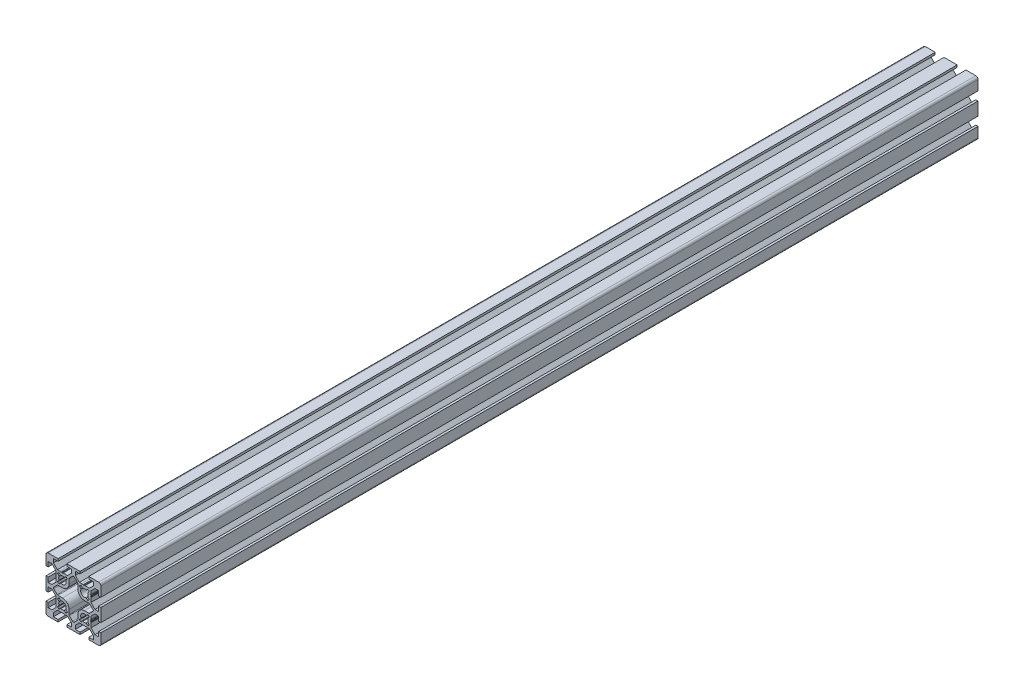
from build123d import *

# Parameters (mm, degrees)
BOSS_EXTRUDE1_DEPTH = 800
CUT_EXTRUDE1_DEPTH  = 801.780868902
CUT_EXTRUDE2_DEPTH  = 801.780868902
CUT_EXTRUDE3_DEPTH  = 801.780868902
CUT_EXTRUDE4_DEPTH  = 801.780868902


with BuildPart() as part:
    # Sketch1 → Boss-Extrude1 (new body)
    with BuildSketch(Plane.XY):
        with BuildLine():
            Line((-25, 23), (-25, 14))
            Line((-25, 14), (-23, 14))
            Line((-23, 14), (-23, 18.25))
            Line((-23, 18.25), (-19.664213562, 18.25))
            Line((-19.664213562, 18.25), (-16, 14.585786438))
            Line((-16, 14.585786438), (-16, 10.653589838))
            ThreePointArc((-16, 10.653589838), (-15.982962913, 10.524180316), (-15.933012702, 10.403589838))
            Line((-15.933012702, 10.403589838), (-15.7, 10))
            Line((-15.7, 10), (-15.933012702, 9.596410162))
            ThreePointArc((-15.933012702, 9.596410162), (-16, 9.346410162), (-15.933012702, 9.096410162))
            Line((-15.933012702, 9.096410162), (-15.750976592, 8.781114371))
            Line((-15.750976592, 8.781114371), (-16, 7.5))
            Line((-16, 7.5), (-16, 5.414213562))
            Line((-16, 5.414213562), (-19.664213562, 1.75))
            Line((-19.664213562, 1.75), (-23, 1.75))
            Line((-23, 1.75), (-23, 6))
            Line((-23, 6), (-25, 6))
            Line((-25, 6), (-25, -6))
            Line((-25, -6), (-23, -6))
            Line((-23, -6), (-23, -1.75))
            Line((-23, -1.75), (-19.664213562, -1.75))
            Line((-19.664213562, -1.75), (-16, -5.414213562))
            Line((-16, -5.414213562), (-16, -9.346410162))
            ThreePointArc((-16, -9.346410162), (-15.982962913, -9.475819684), (-15.933012702, -9.596410162))
            Line((-15.933012702, -9.596410162), (-15.7, -10))
            Line((-15.7, -10), (-15.933012702, -10.403589838))
            ThreePointArc((-15.933012702, -10.403589838), (-16, -10.653589838), (-15.933012702, -10.903589838))
            Line((-15.933012702, -10.903589838), (-15.750976592, -11.218885629))
            Line((-15.750976592, -11.218885629), (-16, -12.5))
            Line((-16, -12.5), (-16, -14.585786438))
            Line((-16, -14.585786438), (-19.664213562, -18.25))
            Line((-19.664213562, -18.25), (-23, -18.25))
            Line((-23, -18.25), (-23, -14))
            Line((-23, -14), (-25, -14))
            Line((-25, -14), (-25, -23))
            ThreePointArc((-25, -23), (-24.414213562, -24.414213562), (-23, -25))
            Line((-23, -25), (-14, -25))
            Line((-14, -25), (-14, -23))
            Line((-14, -23), (-18.25, -23))
            Line((-18.25, -23), (-18.25, -19.664213562))
            Line((-18.25, -19.664213562), (-14.585786438, -16))
            Line((-14.585786438, -16), (-10.653589838, -16))
            ThreePointArc((-10.653589838, -16), (-10.524180316, -15.982962913), (-10.403589838, -15.933012702))
            Line((-10.403589838, -15.933012702), (-10, -15.7))
            Line((-10, -15.7), (-9.596410162, -15.933012702))
            ThreePointArc((-9.596410162, -15.933012702), (-9.346410162, -16), (-9.096410162, -15.933012702))
            Line((-9.096410162, -15.933012702), (-8.781114371, -15.750976592))
            Line((-8.781114371, -15.750976592), (-7.5, -16))
            Line((-7.5, -16), (-5.414213562, -16))
            Line((-5.414213562, -16), (-1.75, -19.664213562))
            Line((-1.75, -19.664213562), (-1.75, -23))
            Line((-1.75, -23), (-6, -23))
            Line((-6, -23), (-6, -25))
            Line((-6, -25), (6, -25))
            Line((6, -25), (6, -23))
            Line((6, -23), (1.75, -23))
            Line((1.75, -23), (1.75, -19.664213562))
            Line((1.75, -19.664213562), (5.414213562, -16))
            Line((5.414213562, -16), (9.346410162, -16))
            ThreePointArc((9.346410162, -16), (9.475819684, -15.982962913), (9.596410162, -15.933012702))
            Line((9.596410162, -15.933012702), (10, -15.7))
            Line((10, -15.7), (10.403589838, -15.933012702))
            ThreePointArc((10.403589838, -15.933012702), (10.653589838, -16), (10.903589838, -15.933012702))
            Line((10.903589838, -15.933012702), (11.218885629, -15.750976592))
            Line((11.218885629, -15.750976592), (12.5, -16))
            Line((12.5, -16), (14.585786438, -16))
            Line((14.585786438, -16), (18.25, -19.664213562))
            Line((18.25, -19.664213562), (18.25, -23))
            Line((18.25, -23), (14, -23))
            Line((14, -23), (14, -25))
            Line((14, -25), (23, -25))
            ThreePointArc((23, -25), (24.414213562, -24.414213562), (25, -23))
            Line((25, -23), (25, -14))
            Line((25, -14), (23, -14))
            Line((23, -14), (23, -18.25))
            Line((23, -18.25), (19.664213562, -18.25))
            Line((19.664213562, -18.25), (16, -14.585786438))
            Line((16, -14.585786438), (16, -10.653589838))
            ThreePointArc((16, -10.653589838), (15.982962913, -10.524180316), (15.933012702, -10.403589838))
            Line((15.933012702, -10.403589838), (15.7, -10))
            Line((15.7, -10), (15.933012702, -9.596410162))
            ThreePointArc((15.933012702, -9.596410162), (16, -9.346410162), (15.933012702, -9.096410162))
            Line((15.933012702, -9.096410162), (15.750976592, -8.781114371))
            Line((15.750976592, -8.781114371), (16, -7.5))
            Line((16, -7.5), (16, -5.414213562))
            Line((16, -5.414213562), (19.664213562, -1.75))
            Line((19.664213562, -1.75), (23, -1.75))
            Line((23, -1.75), (23, -6))
            Line((23, -6), (25, -6))
            Line((25, -6), (25, 6))
            Line((25, 6), (23, 6))
            Line((23, 6), (23, 1.75))
            Line((23, 1.75), (19.664213562, 1.75))
            Line((19.664213562, 1.75), (16, 5.414213562))
            Line((16, 5.414213562), (16, 9.346410162))
            ThreePointArc((16, 9.346410162), (15.982962913, 9.475819684), (15.933012702, 9.596410162))
            Line((15.933012702, 9.596410162), (15.7, 10))
            Line((15.7, 10), (15.933012702, 10.403589838))
            ThreePointArc((15.933012702, 10.403589838), (16, 10.653589838), (15.933012702, 10.903589838))
            Line((15.933012702, 10.903589838), (15.750976592, 11.218885629))
            Line((15.750976592, 11.218885629), (16, 12.5))
            Line((16, 12.5), (16, 14.585786438))
            Line((16, 14.585786438), (19.664213562, 18.25))
            Line((19.664213562, 18.25), (23, 18.25))
            Line((23, 18.25), (23, 14))
            Line((23, 14), (25, 14))
            Line((25, 14), (25, 23))
            ThreePointArc((25, 23), (24.414213562, 24.414213562), (23, 25))
            Line((23, 25), (14, 25))
            Line((14, 25), (14, 23))
            Line((14, 23), (18.25, 23))
            Line((18.25, 23), (18.25, 19.664213562))
            Line((18.25, 19.664213562), (14.585786438, 16))
            Line((14.585786438, 16), (10.653589838, 16))
            ThreePointArc((10.653589838, 16), (10.524180316, 15.982962913), (10.403589838, 15.933012702))
            Line((10.403589838, 15.933012702), (10, 15.7))
            Line((10, 15.7), (9.596410162, 15.933012702))
            ThreePointArc((9.596410162, 15.933012702), (9.346410162, 16), (9.096410162, 15.933012702))
            Line((9.096410162, 15.933012702), (8.781114371, 15.750976592))
            Line((8.781114371, 15.750976592), (7.5, 16))
            Line((7.5, 16), (5.414213562, 16))
            Line((5.414213562, 16), (1.75, 19.664213562))
            Line((1.75, 19.664213562), (1.75, 23))
            Line((1.75, 23), (6, 23))
            Line((6, 23), (6, 25))
            Line((6, 25), (-6, 25))
            Line((-6, 25), (-6, 23))
            Line((-6, 23), (-1.75, 23))
            Line((-1.75, 23), (-1.75, 19.664213562))
            Line((-1.75, 19.664213562), (-5.414213562, 16))
            Line((-5.414213562, 16), (-9.346410162, 16))
            ThreePointArc((-9.346410162, 16), (-9.475819684, 15.982962913), (-9.596410162, 15.933012702))
            Line((-9.596410162, 15.933012702), (-10, 15.7))
            Line((-10, 15.7), (-10.403589838, 15.933012702))
            ThreePointArc((-10.403589838, 15.933012702), (-10.653589838, 16), (-10.903589838, 15.933012702))
            Line((-10.903589838, 15.933012702), (-11.218885629, 15.750976592))
            Line((-11.218885629, 15.750976592), (-12.5, 16))
            Line((-12.5, 16), (-14.585786438, 16))
            Line((-14.585786438, 16), (-18.25, 19.664213562))
            Line((-18.25, 19.664213562), (-18.25, 23))
            Line((-18.25, 23), (-14, 23))
            Line((-14, 23), (-14, 25))
            Line((-14, 25), (-23, 25))
            ThreePointArc((-23, 25), (-24.414213562, 24.414213562), (-25, 23))
        make_face()
        with BuildLine():
            Line((-17.878679656, -0.707106781), (-14.878679656, -3.707106781))
            ThreePointArc((-14.878679656, -3.707106781), (-14.554256308, -3.923879533), (-14.171572875, -4))
            Line((-14.171572875, -4), (-10, -4))
            ThreePointArc((-10, -4), (-5.757359313, -5.757359313), (-4, -10))
            Line((-4, -10), (-4, -14.171572875))
            ThreePointArc((-4, -14.171572875), (-3.923879533, -14.554256308), (-3.707106781, -14.878679656))
            Line((-3.707106781, -14.878679656), (-0.707106781, -17.878679656))
            ThreePointArc((-0.707106781, -17.878679656), (0, -18.171572875), (0.707106781, -17.878679656))
            Line((0.707106781, -17.878679656), (3.707106781, -14.878679656))
            ThreePointArc((3.707106781, -14.878679656), (3.923879533, -14.554256308), (4, -14.171572875))
            Line((4, -14.171572875), (4, -10))
            ThreePointArc((4, -10), (5.757359313, -5.757359313), (10, -4))
            Line((10, -4), (14.171572875, -4))
            ThreePointArc((14.171572875, -4), (14.554256308, -3.923879533), (14.878679656, -3.707106781))
            Line((14.878679656, -3.707106781), (17.878679656, -0.707106781))
            ThreePointArc((17.878679656, -0.707106781), (18.171572875, 0), (17.878679656, 0.707106781))
            Line((17.878679656, 0.707106781), (14.878679656, 3.707106781))
            ThreePointArc((14.878679656, 3.707106781), (14.554256308, 3.923879533), (14.171572875, 4))
            Line((14.171572875, 4), (10, 4))
            ThreePointArc((10, 4), (5.757359313, 5.757359313), (4, 10))
            Line((4, 10), (4, 14.171572875))
            ThreePointArc((4, 14.171572875), (3.923879533, 14.554256308), (3.707106781, 14.878679656))
            Line((3.707106781, 14.878679656), (0.707106781, 17.878679656))
            ThreePointArc((0.707106781, 17.878679656), (0, 18.171572875), (-0.707106781, 17.878679656))
            Line((-0.707106781, 17.878679656), (-3.707106781, 14.878679656))
            ThreePointArc((-3.707106781, 14.878679656), (-3.923879533, 14.554256308), (-4, 14.171572875))
            Line((-4, 14.171572875), (-4, 10))
            ThreePointArc((-4, 10), (-5.757359313, 5.757359313), (-10, 4))
            Line((-10, 4), (-14.171572875, 4))
            ThreePointArc((-14.171572875, 4), (-14.554256308, 3.923879533), (-14.878679656, 3.707106781))
            Line((-14.878679656, 3.707106781), (-17.878679656, 0.707106781))
            ThreePointArc((-17.878679656, 0.707106781), (-18.171572875, 0), (-17.878679656, -0.707106781))
        make_face(mode=Mode.SUBTRACT)
    extrude(amount=-BOSS_EXTRUDE1_DEPTH)

    # Sketch2 → Cut-Extrude1 (cut, through all)
    with BuildSketch(Plane.XY):
        with BuildLine():
            Line((-14.242640687, 12.828427125), (-13.205105981, 11.790892418))
            ThreePointArc((-13.205105981, 11.790892418), (-13.095045749, 11.583064884), (-13.120796199, 11.349307631))
            ThreePointArc((-13.120796199, 11.349307631), (-13.4, 10.000000021), (-13.120796216, 8.650692407))
            ThreePointArc((-13.120796216, 8.650692407), (-13.095045745, 8.416935137), (-13.205105981, 8.209107582))
            Line((-13.205105981, 8.209107582), (-14.242640687, 7.171572875))
            ThreePointArc((-14.242640687, 7.171572875), (-14.389087297, 6.818019485), (-14.242640687, 6.464466094))
            Line((-14.242640687, 6.464466094), (-13.535533906, 5.757359313))
            ThreePointArc((-13.535533906, 5.757359313), (-13.181980515, 5.610912703), (-12.828427125, 5.757359313))
            Line((-12.828427125, 5.757359313), (-11.790892418, 6.794894019))
            ThreePointArc((-11.790892418, 6.794894019), (-11.583064884, 6.904954251), (-11.349307631, 6.879203801))
            ThreePointArc((-11.349307631, 6.879203801), (-7.595836944, 7.595836944), (-6.879203801, 11.349307631))
            ThreePointArc((-6.879203801, 11.349307631), (-6.904954251, 11.583064884), (-6.794894019, 11.790892418))
            Line((-6.794894019, 11.790892418), (-5.757359313, 12.828427125))
            ThreePointArc((-5.757359313, 12.828427125), (-5.610912703, 13.181980515), (-5.757359313, 13.535533906))
            Line((-5.757359313, 13.535533906), (-6.464466094, 14.242640687))
            ThreePointArc((-6.464466094, 14.242640687), (-6.818019485, 14.389087297), (-7.171572875, 14.242640687))
            Line((-7.171572875, 14.242640687), (-8.209107582, 13.205105981))
            ThreePointArc((-8.209107582, 13.205105981), (-8.416935116, 13.095045749), (-8.650692369, 13.120796199))
            ThreePointArc((-8.650692369, 13.120796199), (-9.999999979, 13.4), (-11.349307593, 13.120796216))
            ThreePointArc((-11.349307593, 13.120796216), (-11.583064863, 13.095045745), (-11.790892418, 13.205105981))
            Line((-11.790892418, 13.205105981), (-12.828427125, 14.242640687))
            ThreePointArc((-12.828427125, 14.242640687), (-13.181980515, 14.389087297), (-13.535533906, 14.242640687))
            Line((-13.535533906, 14.242640687), (-14.242640687, 13.535533906))
            ThreePointArc((-14.242640687, 13.535533906), (-14.389087297, 13.181980515), (-14.242640687, 12.828427125))
        make_face()
    extrude(amount=-CUT_EXTRUDE1_DEPTH, mode=Mode.SUBTRACT)

    # Sketch3 → Cut-Extrude2 (cut, through all)
    with BuildSketch(Plane.XY):
        with BuildLine():
            Line((-12.828427125, -14.242640687), (-11.790892418, -13.205105981))
            ThreePointArc((-11.790892418, -13.205105981), (-11.583064884, -13.095045749), (-11.349307631, -13.120796199))
            ThreePointArc((-11.349307631, -13.120796199), (-10.000000021, -13.4), (-8.650692407, -13.120796216))
            ThreePointArc((-8.650692407, -13.120796216), (-8.416935137, -13.095045745), (-8.209107582, -13.205105981))
            Line((-8.209107582, -13.205105981), (-7.171572875, -14.242640687))
            ThreePointArc((-7.171572875, -14.242640687), (-6.818019485, -14.389087297), (-6.464466094, -14.242640687))
            Line((-6.464466094, -14.242640687), (-5.757359313, -13.535533906))
            ThreePointArc((-5.757359313, -13.535533906), (-5.610912703, -13.181980515), (-5.757359313, -12.828427125))
            Line((-5.757359313, -12.828427125), (-6.794894019, -11.790892418))
            ThreePointArc((-6.794894019, -11.790892418), (-6.904954251, -11.583064884), (-6.879203801, -11.349307631))
            ThreePointArc((-6.879203801, -11.349307631), (-7.595836944, -7.595836944), (-11.349307631, -6.879203801))
            ThreePointArc((-11.349307631, -6.879203801), (-11.583064884, -6.904954251), (-11.790892418, -6.794894019))
            Line((-11.790892418, -6.794894019), (-12.828427125, -5.757359313))
            ThreePointArc((-12.828427125, -5.757359313), (-13.181980515, -5.610912703), (-13.535533906, -5.757359313))
            Line((-13.535533906, -5.757359313), (-14.242640687, -6.464466094))
            ThreePointArc((-14.242640687, -6.464466094), (-14.389087297, -6.818019485), (-14.242640687, -7.171572875))
            Line((-14.242640687, -7.171572875), (-13.205105981, -8.209107582))
            ThreePointArc((-13.205105981, -8.209107582), (-13.095045749, -8.416935116), (-13.120796199, -8.650692369))
            ThreePointArc((-13.120796199, -8.650692369), (-13.4, -9.999999979), (-13.120796216, -11.349307593))
            ThreePointArc((-13.120796216, -11.349307593), (-13.095045745, -11.583064863), (-13.205105981, -11.790892418))
            Line((-13.205105981, -11.790892418), (-14.242640687, -12.828427125))
            ThreePointArc((-14.242640687, -12.828427125), (-14.389087297, -13.181980515), (-14.242640687, -13.535533906))
            Line((-14.242640687, -13.535533906), (-13.535533906, -14.242640687))
            ThreePointArc((-13.535533906, -14.242640687), (-13.181980515, -14.389087297), (-12.828427125, -14.242640687))
        make_face()
    extrude(amount=-CUT_EXTRUDE2_DEPTH, mode=Mode.SUBTRACT)

    # Sketch4 → Cut-Extrude3 (cut, through all)
    with BuildSketch(Plane.XY):
        with BuildLine():
            Line((14.242640687, -12.828427125), (13.205105981, -11.790892418))
            ThreePointArc((13.205105981, -11.790892418), (13.095045749, -11.583064884), (13.120796199, -11.349307631))
            ThreePointArc((13.120796199, -11.349307631), (13.4, -10.000000021), (13.120796216, -8.650692407))
            ThreePointArc((13.120796216, -8.650692407), (13.095045745, -8.416935137), (13.205105981, -8.209107582))
            Line((13.205105981, -8.209107582), (14.242640687, -7.171572875))
            ThreePointArc((14.242640687, -7.171572875), (14.389087297, -6.818019485), (14.242640687, -6.464466094))
            Line((14.242640687, -6.464466094), (13.535533906, -5.757359313))
            ThreePointArc((13.535533906, -5.757359313), (13.181980515, -5.610912703), (12.828427125, -5.757359313))
            Line((12.828427125, -5.757359313), (11.790892418, -6.794894019))
            ThreePointArc((11.790892418, -6.794894019), (11.583064884, -6.904954251), (11.349307631, -6.879203801))
            ThreePointArc((11.349307631, -6.879203801), (7.595836944, -7.595836944), (6.879203801, -11.349307631))
            ThreePointArc((6.879203801, -11.349307631), (6.904954251, -11.583064884), (6.794894019, -11.790892418))
            Line((6.794894019, -11.790892418), (5.757359313, -12.828427125))
            ThreePointArc((5.757359313, -12.828427125), (5.610912703, -13.181980515), (5.757359313, -13.535533906))
            Line((5.757359313, -13.535533906), (6.464466094, -14.242640687))
            ThreePointArc((6.464466094, -14.242640687), (6.818019485, -14.389087297), (7.171572875, -14.242640687))
            Line((7.171572875, -14.242640687), (8.209107582, -13.205105981))
            ThreePointArc((8.209107582, -13.205105981), (8.416935116, -13.095045749), (8.650692369, -13.120796199))
            ThreePointArc((8.650692369, -13.120796199), (9.999999979, -13.4), (11.349307593, -13.120796216))
            ThreePointArc((11.349307593, -13.120796216), (11.583064863, -13.095045745), (11.790892418, -13.205105981))
            Line((11.790892418, -13.205105981), (12.828427125, -14.242640687))
            ThreePointArc((12.828427125, -14.242640687), (13.181980515, -14.389087297), (13.535533906, -14.242640687))
            Line((13.535533906, -14.242640687), (14.242640687, -13.535533906))
            ThreePointArc((14.242640687, -13.535533906), (14.389087297, -13.181980515), (14.242640687, -12.828427125))
        make_face()
    extrude(amount=-CUT_EXTRUDE3_DEPTH, mode=Mode.SUBTRACT)

    # Sketch5 → Cut-Extrude4 (cut, through all)
    with BuildSketch(Plane.XY):
        with BuildLine():
            Line((12.828427125, 14.242640687), (11.790892418, 13.205105981))
            ThreePointArc((11.790892418, 13.205105981), (11.583064884, 13.095045749), (11.349307631, 13.120796199))
            ThreePointArc((11.349307631, 13.120796199), (10.000000021, 13.4), (8.650692407, 13.120796216))
            ThreePointArc((8.650692407, 13.120796216), (8.416935137, 13.095045745), (8.209107582, 13.205105981))
            Line((8.209107582, 13.205105981), (7.171572875, 14.242640687))
            ThreePointArc((7.171572875, 14.242640687), (6.818019485, 14.389087297), (6.464466094, 14.242640687))
            Line((6.464466094, 14.242640687), (5.757359313, 13.535533906))
            ThreePointArc((5.757359313, 13.535533906), (5.610912703, 13.181980515), (5.757359313, 12.828427125))
            Line((5.757359313, 12.828427125), (6.794894019, 11.790892418))
            ThreePointArc((6.794894019, 11.790892418), (6.904954251, 11.583064884), (6.879203801, 11.349307631))
            ThreePointArc((6.879203801, 11.349307631), (7.595836944, 7.595836944), (11.349307631, 6.879203801))
            ThreePointArc((11.349307631, 6.879203801), (11.583064884, 6.904954251), (11.790892418, 6.794894019))
            Line((11.790892418, 6.794894019), (12.828427125, 5.757359313))
            ThreePointArc((12.828427125, 5.757359313), (13.181980515, 5.610912703), (13.535533906, 5.757359313))
            Line((13.535533906, 5.757359313), (14.242640687, 6.464466094))
            ThreePointArc((14.242640687, 6.464466094), (14.389087297, 6.818019485), (14.242640687, 7.171572875))
            Line((14.242640687, 7.171572875), (13.205105981, 8.209107582))
            ThreePointArc((13.205105981, 8.209107582), (13.095045749, 8.416935116), (13.120796199, 8.650692369))
            ThreePointArc((13.120796199, 8.650692369), (13.4, 9.999999979), (13.120796216, 11.349307593))
            ThreePointArc((13.120796216, 11.349307593), (13.095045745, 11.583064863), (13.205105981, 11.790892418))
            Line((13.205105981, 11.790892418), (14.242640687, 12.828427125))
            ThreePointArc((14.242640687, 12.828427125), (14.389087297, 13.181980515), (14.242640687, 13.535533906))
            Line((14.242640687, 13.535533906), (13.535533906, 14.242640687))
            ThreePointArc((13.535533906, 14.242640687), (13.181980515, 14.389087297), (12.828427125, 14.242640687))
        make_face()
    extrude(amount=-CUT_EXTRUDE4_DEPTH, mode=Mode.SUBTRACT)


solid = part.part
